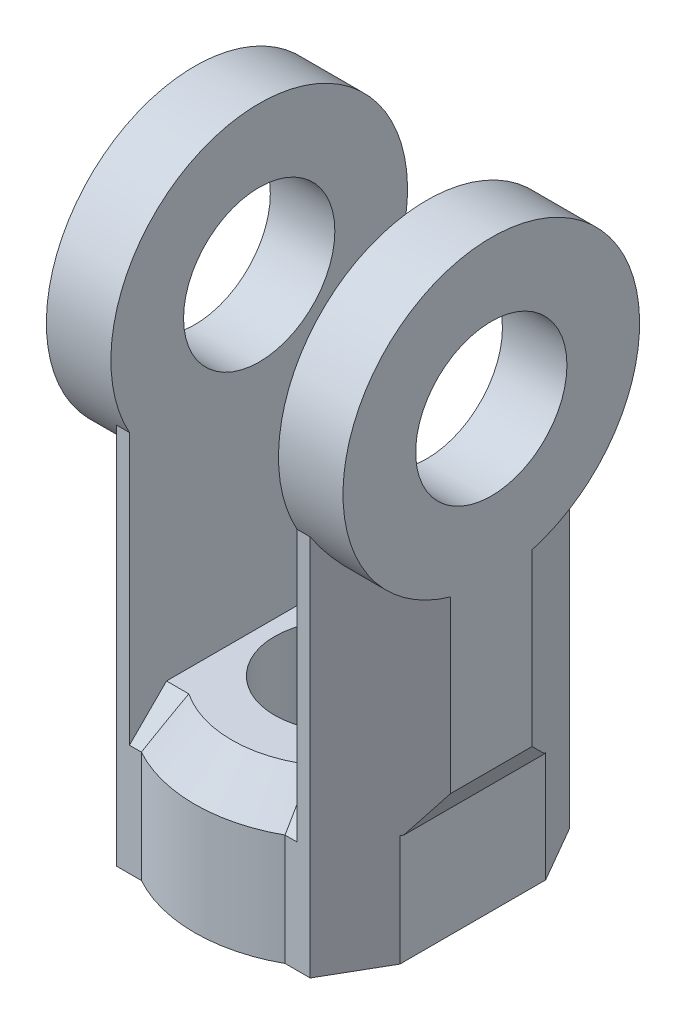
from build123d import *
from OCP.BRepFilletAPI import BRepFilletAPI_MakeChamfer

# Parameters (mm, degrees)
BOSS_EXTRUDE1_DEPTH   = 25.4
SKETCH2_W             = 11.049
SKETCH2_H             = 44.45
BOSS_EXTRUDE2_DEPTH   = 52.324
CHAMFER1_SIZE         = 6.35
F_1_12_TAPPED_HOLE1_D = 23.41626
CHAMFER2_SIZE         = 15.24
CHAMFER2_SIZE2        = 8.798818102
SKETCH5_W             = 31.303655522
SKETCH5_H             = 45.499968027
CUT_EXTRUDE1_DEPTH    = 19.05
BOSS_EXTRUDE3_REACH   = 98.264
SKETCH6_R             = 25.4
BOSS_EXTRUDE4_START   = -50.8
SKETCH6_2_R           = 25.4
BOSS_EXTRUDE4_DEPTH   = 11.049
SKETCH7_R             = 12.954
CUT_EXTRUDE2_DEPTH    = 118.730027504
CHAMFER4_SIZE         = 5.08
CHAMFER4_SIZE2        = 2.932939367


with BuildPart() as part:
    # Sketch1 → Boss-Extrude1 (new body)
    with BuildSketch(Plane(origin=(0, 0, 0), x_dir=(1, 0, 0), z_dir=(0, 1, 0))):
        with BuildLine():
            Line((-25.4, -22.225), (-12.296722124, -22.225))
            ThreePointArc((-12.296722124, -22.225), (0, -25.4), (12.296722124, -22.225))
            Line((12.296722124, -22.225), (25.4, -22.225))
            Line((25.4, -22.225), (25.4, 22.225))
            Line((25.4, 22.225), (12.296722124, 22.225))
            ThreePointArc((12.296722124, 22.225), (0, 25.4), (-12.296722124, 22.225))
            Line((-12.296722124, 22.225), (-25.4, 22.225))
            Line((-25.4, 22.225), (-25.4, -22.225))
        make_face()
    extrude(amount=BOSS_EXTRUDE1_DEPTH)

    # Sketch2 → Boss-Extrude2 (add)
    with BuildSketch(Plane(origin=(0, 25.4, 0), x_dir=(1, 0, 0), z_dir=(0, 1, 0))):
        with Locations((-19.8755, 0)):
            Rectangle(SKETCH2_W, SKETCH2_H)
        with Locations((19.8755, 0)):
            Rectangle(SKETCH2_W, SKETCH2_H)
    extrude(amount=BOSS_EXTRUDE2_DEPTH)

    # Chamfer1
    chamfer1_edges = [part.edges().sort_by_distance(p)[0] for p in [
        (0, 25.4, 25.4),
        (13.323861062, 25.4, 22.225),
        (-13.323861062, 25.4, 22.225),
        (13.323861062, 25.4, -22.225),
        (0, 25.4, -25.4),
        (-13.323861062, 25.4, -22.225),
    ]]
    chamfer(chamfer1_edges, length=CHAMFER1_SIZE)

    # 1-12 Tapped Hole1 (through all)
    with Locations(Plane(origin=(0, 0, 0), x_dir=(-1, 0, 0), z_dir=(0, -1, 0))):
        with Locations((0, 0)):
            Hole(F_1_12_TAPPED_HOLE1_D / 2)

    # Chamfer2: one chamfer whose edges measure the first distance from different faces: ONE call of the kernel's chamfer builder (chamfer() names one face for all edges)
    chamfer2_edges_1 = [part.edges().sort_by_distance(p)[0] for p in [
        (25.4, 38.862, -22.225),
        (25.4, 38.862, 22.225),
    ]]
    chamfer2_side_1 = [part.faces().sort_by_distance(p)[0] for p in [
        (25.4, 38.862, 0),
    ]]
    chamfer2_edges_2 = [part.edges().sort_by_distance(p)[0] for p in [
        (-25.4, 38.862, 22.225),
        (-25.4, 38.862, -22.225),
    ]]
    chamfer2_side_2 = [part.faces().sort_by_distance(p)[0] for p in [
        (-25.4, 38.862, 0),
    ]]
    chamfer2 = BRepFilletAPI_MakeChamfer(part.part.solid().wrapped)
    for e in chamfer2_edges_1:
        chamfer2.Add(CHAMFER2_SIZE, CHAMFER2_SIZE2, e.wrapped, chamfer2_side_1[0].wrapped)  # the first distance lies on this face
    for e in chamfer2_edges_2:
        chamfer2.Add(CHAMFER2_SIZE, CHAMFER2_SIZE2, e.wrapped, chamfer2_side_2[0].wrapped)  # the first distance lies on this face
    add(Compound.cast(chamfer2.Shape()), mode=Mode.REPLACE)

    # Sketch5 → Cut-Extrude1 (cut)
    with BuildSketch(Plane.XZ):
        with Locations((-37.876827761, -1.94234058)):
            Rectangle(SKETCH5_W, SKETCH5_H)
        with Locations((37.876827761, -1.94234058)):
            Rectangle(SKETCH5_W, SKETCH5_H)
    extrude(amount=-CUT_EXTRUDE1_DEPTH, mode=Mode.SUBTRACT)

    # Boss-Extrude3: up to this face of the body (flat: up to its plane)
    boss_extrude3_end = Plane(part.part.faces().sort_by_distance((14.351, 51.080086798, 0))[0])
    # Sketch6 → Boss-Extrude3 (add, up to the picked face)
    with BuildSketch(Plane(origin=(25.4, 0, 0), x_dir=(0, 0, -1), z_dir=(1, 0, 0)), mode=Mode.PRIVATE) as boss_extrude3_sk1:
        with Locations((0, 77.724)):
            Circle(SKETCH6_R)
    boss_extrude3_tool1 = split(extrude(boss_extrude3_sk1.sketch, amount=-BOSS_EXTRUDE3_REACH, mode=Mode.PRIVATE), bisect_by=boss_extrude3_end, keep=Keep.BOTH, mode=Mode.PRIVATE)
    add(boss_extrude3_tool1.solids().sort_by(Axis((25.4, 77.724, 0), (-1, 0, 0)))[0])

    # Sketch6<2> → Boss-Extrude4 (add)
    with BuildSketch(Plane(origin=(25.4, 0, 0), x_dir=(0, 0, -1), z_dir=(1, 0, 0)).offset(BOSS_EXTRUDE4_START)):
        with Locations((0, 77.724)):
            Circle(SKETCH6_2_R)
    extrude(amount=BOSS_EXTRUDE4_DEPTH)

    # Sketch7 → Cut-Extrude2 (cut, through all)
    with BuildSketch(Plane(origin=(25.4, 0, 0), x_dir=(0, 0, -1), z_dir=(1, 0, 0))):
        with Locations((0, 77.724)):
            Circle(SKETCH7_R)
    extrude(amount=-CUT_EXTRUDE2_DEPTH, mode=Mode.SUBTRACT)

    # Chamfer4: one chamfer whose edges measure the first distance from different faces: ONE call of the kernel's chamfer builder (chamfer() names one face for all edges)
    chamfer4_edges_1 = [part.edges().sort_by_distance(p)[0] for p in [
        (-25.4, 19.05, 0),
    ]]
    chamfer4_side_1 = [part.faces().sort_by_distance(p)[0] for p in [
        (-25.4, 36.176658328, -6.002702821),
    ]]
    chamfer4_edges_2 = [part.edges().sort_by_distance(p)[0] for p in [
        (25.4, 19.05, 0),
    ]]
    chamfer4_side_2 = [part.faces().sort_by_distance(p)[0] for p in [
        (25.4, 102.141702821, 0),
    ]]
    chamfer4 = BRepFilletAPI_MakeChamfer(part.part.solid().wrapped)
    for e in chamfer4_edges_1:
        chamfer4.Add(CHAMFER4_SIZE, CHAMFER4_SIZE2, e.wrapped, chamfer4_side_1[0].wrapped)  # the first distance lies on this face
    for e in chamfer4_edges_2:
        chamfer4.Add(CHAMFER4_SIZE, CHAMFER4_SIZE2, e.wrapped, chamfer4_side_2[0].wrapped)  # the first distance lies on this face
    add(Compound.cast(chamfer4.Shape()), mode=Mode.REPLACE)


solid = part.part
